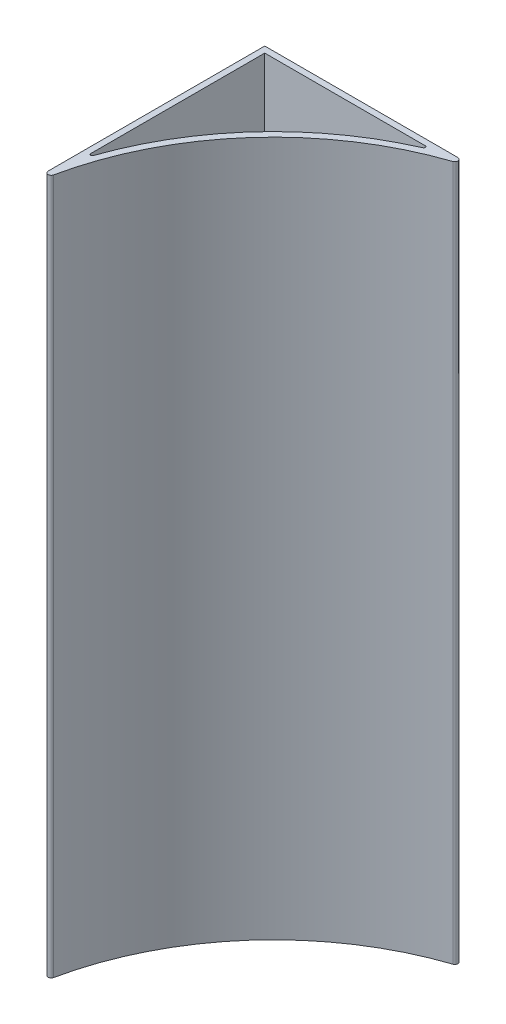
from build123d import *

# Parameters (mm, degrees)
BOSS_EXTRUDE1_DEPTH      = 113.5
BOSS_EXTRUDE1_DEPTH_BACK = 113.5
SKETCH3_W                = 9.8
SKETCH3_H                = 19.8
CUT_EXTRUDE1_DEPTH       = 5


with BuildPart() as part:
    # Sketch2 → Boss-Extrude1 (new, two sides: drawn at the far end of the back side and taken through both)
    with BuildSketch(Plane(origin=(0, 0, 0), x_dir=(-1, 0, 0), z_dir=(0, 1, 0)).offset(-BOSS_EXTRUDE1_DEPTH_BACK)):
        with BuildLine():
            Line((6.944925281, 0), (70, 0))
            Line((70, 0), (70, 70.727517767))
            ThreePointArc((70, 70.727517767), (69.10322059, 71.722176256), (68.02130898, 70.932856238))
            ThreePointArc((68.02130898, 70.932856238), (46.50806151, 28.267371652), (6.627399441, 1.948249619))
            ThreePointArc((6.627399441, 1.948249619), (5.957947667, 0.839142329), (6.944925281, 0))
        make_face()
        with BuildLine():
            Line((68, 58.856286255), (68, 2))
            Line((68, 2), (15.588847456, 2))
            ThreePointArc((15.588847456, 2), (15.099520976, 2.397240103), (15.387714901, 2.957761614))
            ThreePointArc((15.387714901, 2.957761614), (47.071395865, 25.58711402), (67.027291068, 59.019216502))
            ThreePointArc((67.027291068, 59.019216502), (67.582600042, 59.349416291), (68, 58.856286255))
        make_face(mode=Mode.SUBTRACT)
    extrude(amount=BOSS_EXTRUDE1_DEPTH + BOSS_EXTRUDE1_DEPTH_BACK)

    # Sketch3 → Cut-Extrude1 (cut)
    with BuildSketch(Plane(origin=(0, 0, 0), x_dir=(1, 0, 0), z_dir=(0, 0, -1))):
        with Locations((-35, -59.9)):
            Rectangle(SKETCH3_W, SKETCH3_H)
        with Locations((-35, 59.9)):
            Rectangle(SKETCH3_W, SKETCH3_H)
    extrude(amount=-CUT_EXTRUDE1_DEPTH, mode=Mode.SUBTRACT)


solid = part.part
